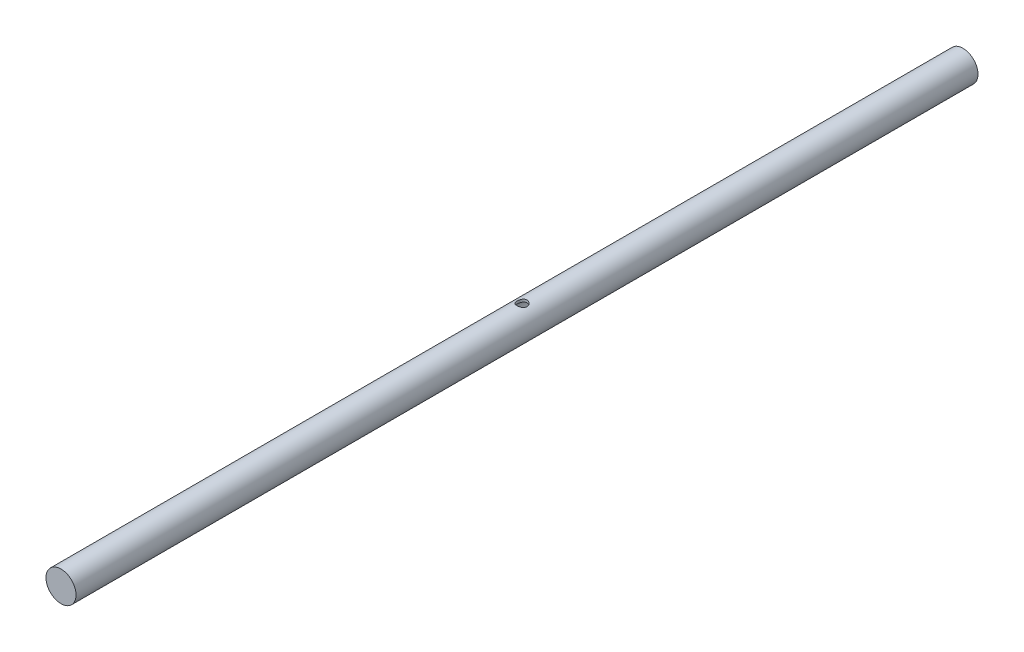
from build123d import *

# Parameters (mm, degrees)
SKETCH1_R           = 3.81
BOSS_EXTRUDE1_DEPTH = 228.6
SHELL1_T            = -0.635
SKETCH3_R           = 1.27
CUT_EXTRUDE3_DEPTH  = 5.08


with BuildPart() as part:
    # Sketch1 → Boss-Extrude1 (new body)
    with BuildSketch(Plane.XY):
        Circle(SKETCH1_R)
    extrude(amount=BOSS_EXTRUDE1_DEPTH)

    # Shell1
    shell1_openings = [part.faces().sort_by_distance(p)[0] for p in [
        (0, 0, 0),
    ]]
    offset(amount=SHELL1_T, openings=shell1_openings, kind=Kind.INTERSECTION)

    # Sketch3 → Cut-Extrude3 (cut)
    with BuildSketch(Plane(origin=(0, 0, 0), x_dir=(1, 0, 0), z_dir=(0, 1, 0))):
        with Locations(Location((0, -111.76, 0), (0, 0, 90))):
            Circle(SKETCH3_R)
    extrude(amount=CUT_EXTRUDE3_DEPTH, mode=Mode.SUBTRACT)


solid = part.part
